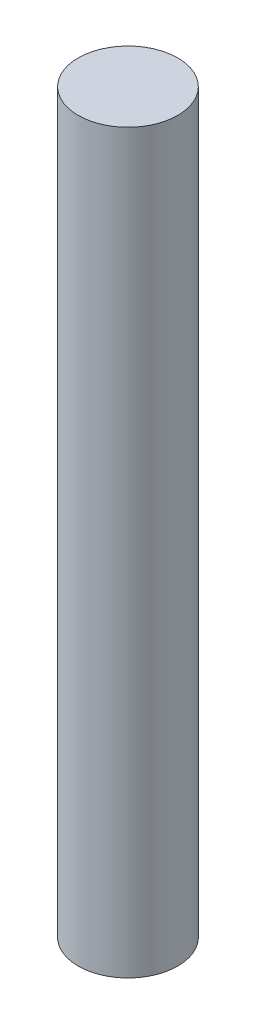
from build123d import *

# Parameters (mm, degrees)
SKETCH2_R           = 2.5
BOSS_EXTRUDE1_DEPTH = 37


with BuildPart() as part:
    # Sketch2 → Boss-Extrude1 (new body)
    with BuildSketch(Plane(origin=(0, 0, 0), x_dir=(1, 0, 0), z_dir=(0, 1, 0))):
        with Locations(Location((0, 0, 0), (0, 0, 270))):
            Circle(SKETCH2_R)
    extrude(amount=BOSS_EXTRUDE1_DEPTH)


solid = part.part
